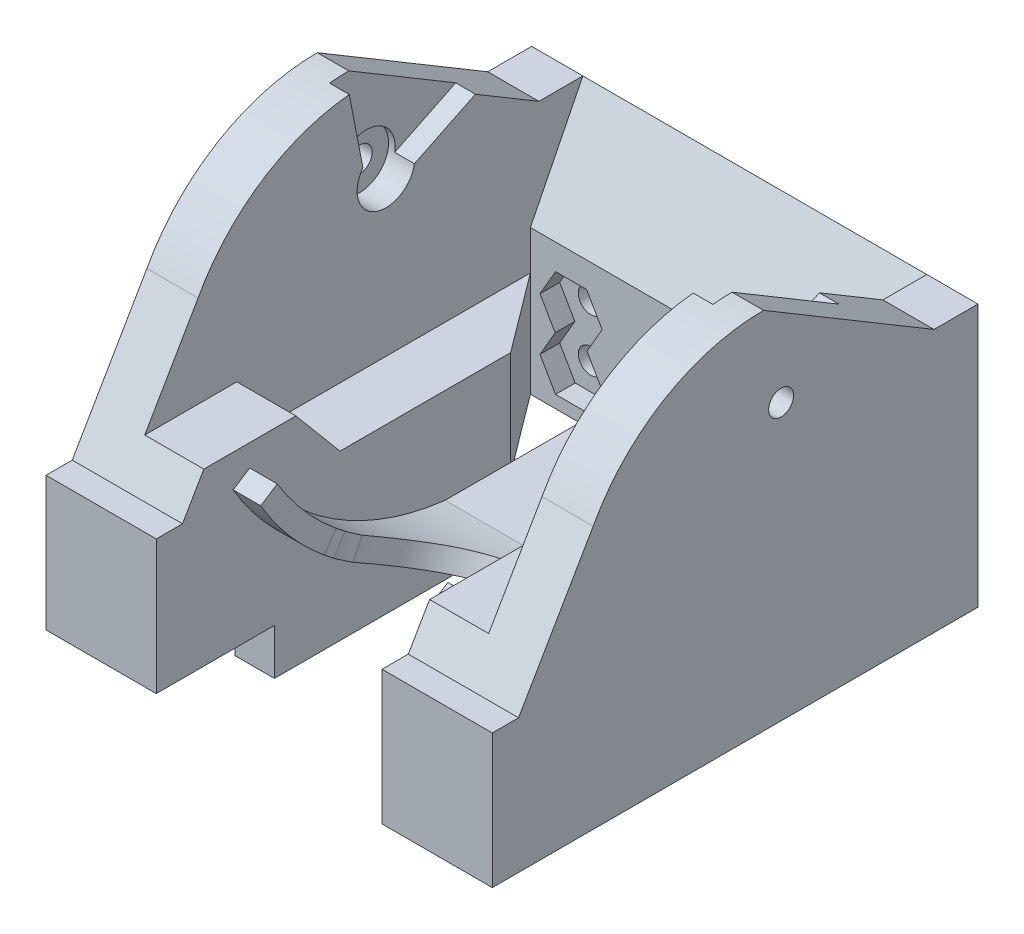
from build123d import *

# Parameters (mm, degrees)
CROQUIS1_W                 = 34
CROQUIS1_H                 = 19
SALIENTE_EXTRUIR1_DEPTH    = 35
CROQUIS2_W                 = 26.2
CROQUIS2_H                 = 31
CORTAR_EXTRUIR1_DEPTH      = 25
CORTAR_EXTRUIR3_DEPTH      = 26.2
SALIENTE_EXTRUIR2_DEPTH    = 34
CROQUIS10_W                = 26.2
CROQUIS10_H                = 25.966324345
CORTAR_EXTRUIR4_DEPTH      = 10
CROQUIS18_R                = 0.95
CORTAR_EXTRUIR11_DEPTH     = 4
CORTAR_EXTRUIR12_DEPTH     = 1.5
CORTAR_EXTRUIR14_START     = -34
CROQUIS21_R                = 0.95
CORTAR_EXTRUIR14_DEPTH     = 34
SALIENTE_EXTRUIR3_DEPTH    = 8
CROQUIS25_W                = 3
CROQUIS25_H                = 25
SALIENTE_EXTRUIR4_DEPTH    = 3
CROQUIS43_W                = 4.5
CROQUIS43_H                = 12
SALIENTE_EXTRUIR8_DEPTH    = 4
CORTAR_EXTRUIR20_START     = -1.5
CORTAR_EXTRUIR20_DEPTH     = 1.5
CORTAR_EXTRUIR21_DEPTH     = 27.7
CORTAR_EXTRUIR22_START     = -34
CORTAR_EXTRUIR22_DEPTH     = 34
CROQUIS36_R                = 2.2
CORTAR_EXTRUIR24_DEPTH     = 2
CORTAR_EXTRUIR25_START     = 28.2
CROQUIS36_2_R              = 2.2
CORTAR_EXTRUIR25_DEPTH     = 28.2
CORTAR_EXTRUIR26_START     = -34
CORTAR_EXTRUIR26_DEPTH     = 34
CORTAR_EXTRUIR28_START     = -23.2
CORTAR_EXTRUIR28_DEPTH     = 23.2
CORTAR_EXTRUIR29_DEPTH     = 26.2
SALIENTE_EXTRUIR9_DEPTH    = 17.2
CROQUIS49_R                = 6.5
CROQUIS50_R                = 6.5
SALIENTE_EXTRUIR15_DEPTH   = 2
SALIENTE_EXTRUIR15_2_DEPTH = 2
SALIENTE_EXTRUIR30_DEPTH   = 1
CROQUIS61_W                = 17.2
CROQUIS61_H                = 1.5
SALIENTE_EXTRUIR31_DEPTH   = 11
SALIENTE_EXTRUIR32_START   = -17.2
SALIENTE_EXTRUIR32_DEPTH   = 17.2
CROQUIS63_W                = 3
CROQUIS63_H                = 15
SALIENTE_EXTRUIR33_DEPTH   = 1.5
CROQUIS64_W                = 23.2
CROQUIS64_H                = 9
CORTAR_EXTRUIR30_DEPTH     = 2.000001
CORTAR_EXTRUIR31_START     = -23.2
CORTAR_EXTRUIR31_DEPTH     = 23.2


with BuildPart() as part:
    # Croquis1 → Saliente-Extruir1 (new body)
    with BuildSketch(Plane.XY):
        with Locations((-31.887263086, 5.12254902)):
            Rectangle(CROQUIS1_W, CROQUIS1_H)
    extrude(amount=SALIENTE_EXTRUIR1_DEPTH)

    # Croquis2 → Cortar-Extruir1 (cut)
    with BuildSketch(Plane.XZ.offset(4.37745098)):
        with Locations((-31.887263086, 19.5)):
            Rectangle(CROQUIS2_W, CROQUIS2_H)
    extrude(amount=-CORTAR_EXTRUIR1_DEPTH, mode=Mode.SUBTRACT)

    # Croquis4 → Cortar-Extruir3 (cut)
    with BuildSketch(Plane.ZY.offset(18.787263086)):
        Polygon((4, 14.62254902), (4, 6.62254902), (0, 14.62254902), align=None)
    extrude(amount=CORTAR_EXTRUIR3_DEPTH, mode=Mode.SUBTRACT)

    # Croquis9 → Saliente-Extruir2 (add)
    with BuildSketch(Plane(origin=(-14.887263086, 0, 0), x_dir=(0, 0, -1), z_dir=(1, 0, 0))):
        with BuildLine():
            Line((-29.315831827, 14.62254902), (-3.349507482, 14.62254902))
            ThreePointArc((-3.349507482, 14.62254902), (-16.332669655, 22.37254902), (-29.315831827, 14.62254902))
        make_face()
    extrude(amount=-SALIENTE_EXTRUIR2_DEPTH)

    # Croquis10 → Cortar-Extruir4 (cut)
    with BuildSketch(Plane.XZ.offset(-14.62254902)):
        with Locations((-31.887263086, 16.332669655)):
            Rectangle(CROQUIS10_W, CROQUIS10_H)
    extrude(amount=-CORTAR_EXTRUIR4_DEPTH, mode=Mode.SUBTRACT)

    # Croquis18 → Cortar-Extruir11 (cut)
    with BuildSketch(Plane(origin=(0, 0, 0), x_dir=(-1, 0, 0), z_dir=(0, 0, -1))):
        with Locations((41.887263086, -1.37745098)):
            Circle(CROQUIS18_R)
        with Locations((21.887263086, -1.37745098)):
            Circle(CROQUIS18_R)
        with Locations((21.887263086, 2.62254902)):
            Circle(CROQUIS18_R)
        with Locations((41.887263086, 2.62254902)):
            Circle(CROQUIS18_R)
    extrude(amount=-CORTAR_EXTRUIR11_DEPTH, mode=Mode.SUBTRACT)

    # Croquis19 → Cortar-Extruir12 (cut)
    with BuildSketch(Plane.XY.offset(4)):
        Polygon((-44.254399189, -1.37745098), (-43.070831137, -3.42745098), (-40.703695034, -3.42745098), (-39.520126982, -1.37745098), (-40.67482752, 0.62254902), (-39.520126982, 2.62254902), (-40.703695034, 4.67254902), (-43.070831137, 4.67254902), (-44.254399189, 2.62254902), (-43.099698651, 0.62254902), align=None)
        Polygon((-24.254399189, -1.37745098), (-23.070831137, -3.42745098), (-20.703695034, -3.42745098), (-19.520126982, -1.37745098), (-20.67482752, 0.62254902), (-19.520126982, 2.62254902), (-20.703695034, 4.67254902), (-23.070831137, 4.67254902), (-24.254399189, 2.62254902), (-23.099698651, 0.62254902), align=None)
    extrude(amount=-CORTAR_EXTRUIR12_DEPTH, mode=Mode.SUBTRACT)

    # Croquis21 → Cortar-Extruir14 (cut)
    with BuildSketch(Plane(origin=(-14.887263086, 0, 0), x_dir=(0, 0, -1), z_dir=(1, 0, 0)).offset(CORTAR_EXTRUIR14_START)):
        with Locations((-15, 15.62254902)):
            Circle(CROQUIS21_R)
    extrude(amount=CORTAR_EXTRUIR14_DEPTH, mode=Mode.SUBTRACT)

    # Croquis23 → Saliente-Extruir3 (add)
    with BuildSketch(Plane.XZ.offset(4.37745098)):
        Polygon((-44.987263086, 35), (-40.487263086, 35), (-40.487263086, 10), (-44.987263086, 4), align=None)
        Polygon((-18.787263086, 35), (-23.287263086, 35), (-23.287263086, 10), (-18.787263086, 4), align=None)
    extrude(amount=-SALIENTE_EXTRUIR3_DEPTH)

    # Croquis25 → Saliente-Extruir4 (add)
    with BuildSketch(Plane.XZ.offset(4.37745098)):
        with Locations((-41.987263086, 22.5)):
            Rectangle(CROQUIS25_W, CROQUIS25_H)
        with Locations((-21.787263086, 22.5)):
            Rectangle(CROQUIS25_W, CROQUIS25_H)
    extrude(amount=SALIENTE_EXTRUIR4_DEPTH)

    # Croquis43 → Saliente-Extruir8 (add)
    with BuildSketch(Plane(origin=(0, 3.62254902, 0), x_dir=(1, 0, 0), z_dir=(0, 1, 0))):
        with Locations((-21.037263086, -29)):
            Rectangle(CROQUIS43_W, CROQUIS43_H)
        with Locations((-42.737263086, -29)):
            Rectangle(CROQUIS43_W, CROQUIS43_H)
    extrude(amount=SALIENTE_EXTRUIR8_DEPTH)

    # Croquis29 → Cortar-Extruir20 (cut)
    with BuildSketch(Plane.ZY.offset(18.787263086).offset(CORTAR_EXTRUIR20_START)):
        with BuildLine():
            Line((17.797402962, 22.299641931), (16.5, 15.62254902))
            ThreePointArc((16.5, 15.62254902), (15.426958984, 14.184596995), (13.743058632, 14.803953638))
            Line((13.743058632, 14.803953638), (6.296886003, 18.432060872))
            ThreePointArc((6.296886003, 18.432060872), (11.631045274, 21.603150873), (17.797402962, 22.299641931))
        make_face()
    extrude(amount=CORTAR_EXTRUIR20_DEPTH, mode=Mode.SUBTRACT)

    # Croquis29<2> → Cortar-Extruir21 (cut)
    with BuildSketch(Plane.ZY.offset(18.787263086)):
        with BuildLine():
            Line((17.797402962, 22.299641931), (16.5, 15.62254902))
            ThreePointArc((16.5, 15.62254902), (15.426958984, 14.184596995), (13.743058632, 14.803953638))
            Line((13.743058632, 14.803953638), (6.296886003, 18.432060872))
            ThreePointArc((6.296886003, 18.432060872), (11.631045274, 21.603150873), (17.797402962, 22.299641931))
        make_face()
    extrude(amount=CORTAR_EXTRUIR21_DEPTH, mode=Mode.SUBTRACT)

    # Croquis30 → Cortar-Extruir22 (cut)
    with BuildSketch(Plane.ZY.offset(48.887263086).offset(CORTAR_EXTRUIR22_START)):
        Polygon((29.315831827, 14.62254902), (35, 4.827802707), (35, 14.62254902), align=None)
    extrude(amount=CORTAR_EXTRUIR22_DEPTH, mode=Mode.SUBTRACT)

    # Croquis36 → Cortar-Extruir24 (cut)
    with BuildSketch(Plane.ZY.offset(18.787263086)):
        with Locations((15, 15.62254902)):
            Circle(CROQUIS36_R)
    extrude(amount=-CORTAR_EXTRUIR24_DEPTH, mode=Mode.SUBTRACT)

    # Croquis36<2> → Cortar-Extruir25 (cut)
    with BuildSketch(Plane.ZY.offset(18.787263086).offset(CORTAR_EXTRUIR25_START)):
        with Locations((15, 15.62254902)):
            Circle(CROQUIS36_2_R)
    extrude(amount=-CORTAR_EXTRUIR25_DEPTH, mode=Mode.SUBTRACT)

    # Croquis38 → Cortar-Extruir26 (cut)
    with BuildSketch(Plane.ZY.offset(48.887263086).offset(CORTAR_EXTRUIR26_START)):
        Polygon((3.349507482, 14.62254902), (16.332669655, 22.37254902), (3.349507482, 22.37254902), align=None)
    extrude(amount=CORTAR_EXTRUIR26_DEPTH, mode=Mode.SUBTRACT)

    # Croquis41 → Cortar-Extruir28 (cut)
    with BuildSketch(Plane(origin=(-20.287263086, 0, 0), x_dir=(0, 0, -1), z_dir=(1, 0, 0)).offset(CORTAR_EXTRUIR28_START)):
        Polygon((-10, -4.37745098), (-10, -7.37745098), (-13, -7.37745098), align=None)
    extrude(amount=CORTAR_EXTRUIR28_DEPTH, mode=Mode.SUBTRACT)

    # Croquis44 → Cortar-Extruir29 (cut)
    with BuildSketch(Plane.ZY.offset(18.787263086)):
        Polygon((23, 7.62254902), (26.362551066, 7.62254902), (23, 3.62254902), align=None)
    extrude(amount=CORTAR_EXTRUIR29_DEPTH, mode=Mode.SUBTRACT)



with BuildPart() as body_2:
    # Croquis45 → Saliente-Extruir9 (new body)
    with BuildSketch(Plane.ZY.offset(23.287263086)):
        with BuildLine():
            Line((15, -3.62745098), (15, -5.12745098))
            ThreePointArc((15, -5.12745098), (24.320241754, -1.960342727), (31.142668885, 5.135569413))
            Line((31.142668885, 5.135569413), (29.884798582, 5.952736655))
            ThreePointArc((29.884798582, 5.952736655), (23.552170341, -0.561615516), (15, -3.62745098))
        make_face()
    extrude(amount=SALIENTE_EXTRUIR9_DEPTH)

    # Cortar-Barrer2: sweep along a path in Croquis47
    with BuildLine(Plane(origin=(-31.887263086, 4.275439874, 32.372332418), x_dir=(0, 0, -1), z_dir=(1, 0, 0))) as cortar_barrer2_path:
        Line((17.372332418, 11.347109145), (-5.570725036, -21.418972626))
    # Croquis48 → Cortar-Barrer2 (sweep, cut)
    with BuildSketch(Plane(origin=(-31.887263086, -17.143532752, 37.943057454), x_dir=(-1, 0, 0), z_dir=(0, -0.8191520442889911, 0.5735764363510472))):
        with BuildLine():
            Line((6.5, 0), (6.5, -15))
            Line((6.5, -15), (-6.5, -15))
            Line((-6.5, -15), (-6.5, 0))
            ThreePointArc((-6.5, 0), (0, 6.5), (6.5, 0))
        make_face()
    sweep(path=cortar_barrer2_path.line, mode=Mode.SUBTRACT)

    # Cortar-Barrer3: sweep along a path in Croquis51
    with BuildLine(Plane(origin=(-31.887263086, 4.275439874, 32.372332418), x_dir=(0, 0, -1), z_dir=(1, 0, 0))) as cortar_barrer3_path:
        Line((17.372332418, 11.347109145), (-2.627667582, -23.293907006))
    # Croquis49 → Cortar-Barrer3 (sweep, cut)
    with BuildSketch(Plane(origin=(-31.887263086, -19.018467132, 35), x_dir=(-1, 0, 0), z_dir=(0, -0.8660254037844382, 0.5000000000000011))):
        Circle(CROQUIS49_R)
    sweep(path=cortar_barrer3_path.line, mode=Mode.SUBTRACT)

    # Cortar-Barrer4: sweep along a path in Croquis52
    with BuildLine(Plane(origin=(-31.887263086, 4.275439874, 32.372332418), x_dir=(0, 0, -1), z_dir=(1, 0, 0))) as cortar_barrer4_path:
        Line((17.372332418, 11.347109145), (0.467601948, -24.905202336))
    # Croquis50 → Cortar-Barrer4 (sweep, cut)
    with BuildSketch(Plane(origin=(-31.887263086, -20.629762462, 31.90473047), x_dir=(-1, 0, 0), z_dir=(0, -0.9063077870366495, 0.4226182617407004))):
        Circle(CROQUIS50_R)
    sweep(path=cortar_barrer4_path.line, mode=Mode.SUBTRACT)


with BuildPart() as body_3:
    # Croquis56 → Saliente-Extruir15 (new body)
    with BuildSketch(Plane.XY.offset(35)):
        Polygon((-23.287263086, -7.37745098), (-20.287263086, -7.37745098), (-20.287263086, -4.37745098), (-14.887263086, -4.37745098), (-14.887263086, 4.827802707), (-23.287263086, 4.827802707), align=None)
    extrude(amount=SALIENTE_EXTRUIR15_DEPTH)


with BuildPart() as body_4:
    # Croquis56 → Saliente-Extruir15 2 (new body)
    with BuildSketch(Plane.XY.offset(35)):
        Polygon((-40.487263086, -7.37745098), (-40.487263086, 4.827802707), (-48.887263086, 4.827802707), (-48.887263086, -4.37745098), (-43.487263086, -4.37745098), (-43.487263086, -7.37745098), align=None)
    extrude(amount=SALIENTE_EXTRUIR15_2_DEPTH)


with BuildPart() as part_1:
    add(part.part)

    add(body_3.part)  # Saliente-Extruir30 merges body 3

    add(body_4.part)  # Saliente-Extruir30 merges body 4
    # Croquis60 → Saliente-Extruir30 (add)
    with BuildSketch(Plane.XZ.offset(4.37745098)):
        Polygon((-48.887263086, 35), (-48.887263086, 0), (-43.487263086, 10), (-43.487263086, 35), (-43.487263086, 37), (-48.887263086, 37), align=None)
        Polygon((-14.887263086, 0), (-14.887263086, 37), (-20.287263086, 37), (-20.287263086, 10), align=None)
    extrude(amount=SALIENTE_EXTRUIR30_DEPTH)


    add(body_2.part)  # Saliente-Extruir31 merges body 2
    # Croquis61 → Saliente-Extruir31 (add)
    with BuildSketch(Plane(origin=(0, 0, 15), x_dir=(-1, 0, 0), z_dir=(0, 0, -1))):
        with Locations((31.887263086, -4.37745098)):
            Rectangle(CROQUIS61_W, CROQUIS61_H)
    extrude(amount=SALIENTE_EXTRUIR31_DEPTH)

    # Croquis62 → Saliente-Extruir32 (add)
    with BuildSketch(Plane(origin=(-23.287263086, 0, 0), x_dir=(0, 0, -1), z_dir=(1, 0, 0)).offset(SALIENTE_EXTRUIR32_START)):
        Polygon((-4, -4.37745098), (-4, -5.12745098), (0, -4.37745098), align=None)
    extrude(amount=SALIENTE_EXTRUIR32_DEPTH)

    # Croquis63 → Saliente-Extruir33 (add)
    with BuildSketch(Plane.XZ.offset(7.37745098)):
        with Locations((-41.987263086, 20.5)):
            Rectangle(CROQUIS63_W, CROQUIS63_H)
        with Locations((-21.787263086, 20.5)):
            Rectangle(CROQUIS63_W, CROQUIS63_H)
    extrude(amount=SALIENTE_EXTRUIR33_DEPTH)

    # Croquis64 → Cortar-Extruir30 (cut)
    with BuildSketch(Plane.XZ.offset(7.37745098)):
        with Locations((-31.887263086, 32.5)):
            Rectangle(CROQUIS64_W, CROQUIS64_H)
    extrude(amount=-CORTAR_EXTRUIR30_DEPTH, mode=Mode.SUBTRACT)

    # Croquis65 → Cortar-Extruir31 (cut)
    with BuildSketch(Plane.ZY.offset(43.487263086).offset(CORTAR_EXTRUIR31_START)):
        Polygon((13, -7.37745098), (14.5, -8.87745098), (13, -8.87745098), align=None)
    extrude(amount=CORTAR_EXTRUIR31_DEPTH, mode=Mode.SUBTRACT)


solid = part_1.part
